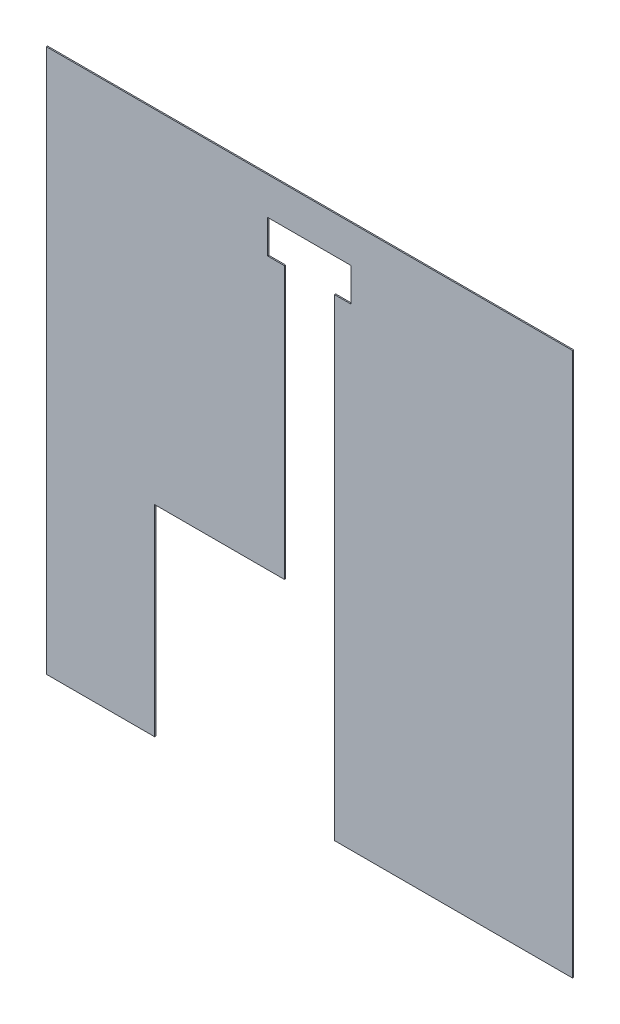
from build123d import *

# Parameters (mm, degrees)
CROQUIS1_W              = 1258.4
CROQUIS1_H              = 1300
SALIENTE_EXTRUIR1_DEPTH = 2.9
CROQUIS2_W              = 200
CROQUIS2_H              = 80
CORTAR_EXTRUIR1_DEPTH   = 10
CORTAR_EXTRUIR2_DEPTH   = 3


with BuildPart() as part:
    # Croquis1 → Saliente-Extruir1 (new body)
    with BuildSketch(Plane.XY):
        with Locations((629.2, -650)):
            Rectangle(CROQUIS1_W, CROQUIS1_H)
    extrude(amount=SALIENTE_EXTRUIR1_DEPTH)

    # Croquis2 → Cortar-Extruir1 (cut)
    with BuildSketch(Plane.XY.offset(2.9)):
        with Locations((629.2, -128.9)):
            Rectangle(CROQUIS2_W, CROQUIS2_H)
    extrude(amount=-CORTAR_EXTRUIR1_DEPTH, mode=Mode.SUBTRACT)

    # Croquis3 → Cortar-Extruir2 (cut)
    with BuildSketch(Plane.XY.offset(2.9)):
        Polygon((569.2, -168.9), (569.2, -818.9), (259.2, -818.9), (259.2, -1300), (689.2, -1300), (689.2, -168.9), align=None)
    extrude(amount=-CORTAR_EXTRUIR2_DEPTH, mode=Mode.SUBTRACT)


solid = part.part
